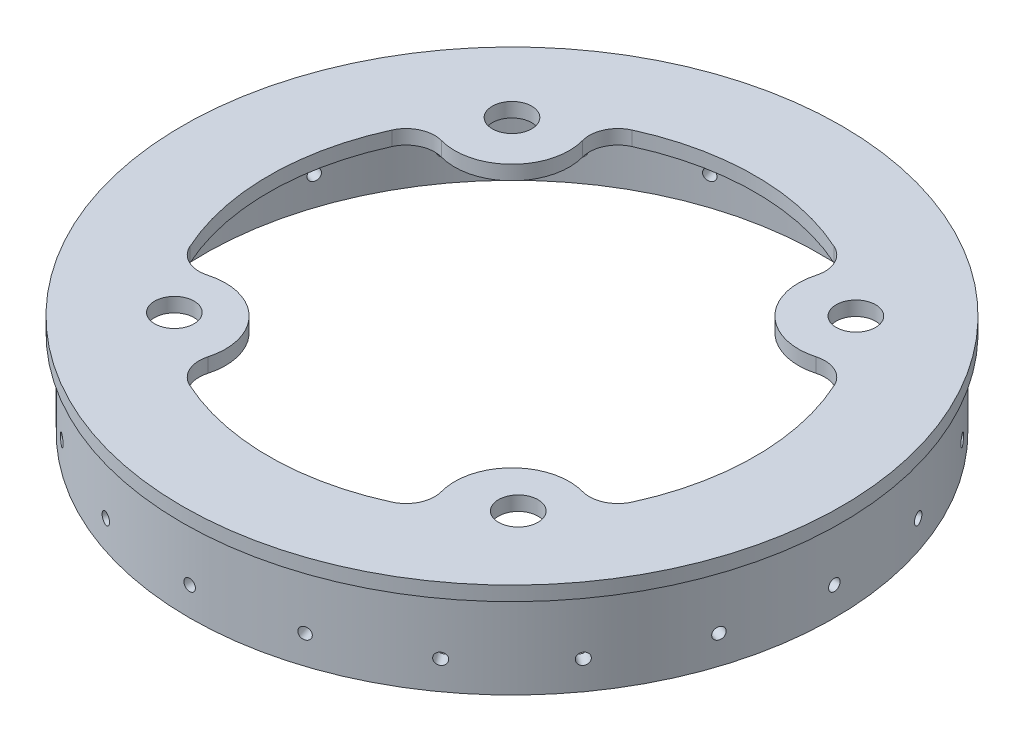
from build123d import *

# Parameters (mm, degrees)
F_1_4_20_TAPPED_HOLE1_REACH  = 327.294
F_1_4_20_TAPPED_HOLE1_BORE_R = 2.5527
CIRPATTERN2_COUNT            = 20
BOSS_EXTRUDE1_START          = -6.35
SKETCH6_R                    = 136.525
BOSS_EXTRUDE1_DEPTH          = 6.35
FILLET1_R                    = 12.7
CHAMFER1_SIZE                = 12.7
F_3_4_16_TAPPED_HOLE1_D      = 17.4625


with BuildPart() as part:
    # Sketch1 → Revolve1 (revolve)
    with BuildSketch(Plane.XY, mode=Mode.PRIVATE) as revolve1_sk:
        Polygon((136.525, 0), (142.875, 0), (142.875, 38.1), (146.05, 38.1), (146.05, 44.45), (136.525, 44.45), align=None)
    revolve(revolve1_sk.sketch.rotate(Axis((0, 75.595186151, 0), (0, -1, 0)), 90), axis=Axis((0, 75.595186151, 0), (0, -1, 0)))

    # 1/4-20 Tapped Hole1 bore (on position points) → 1/4-20 Tapped Hole1 (cut, up to next)
    with BuildSketch(Plane(origin=(-142.875, 12.7, 0), x_dir=(0, 0, -1), z_dir=(-1, 0, 0)), mode=Mode.PRIVATE) as f_1_4_20_tapped_hole1_sk1:
        Circle(F_1_4_20_TAPPED_HOLE1_BORE_R)
    f_1_4_20_tapped_hole1_tool1 = extrude(f_1_4_20_tapped_hole1_sk1.sketch, amount=-F_1_4_20_TAPPED_HOLE1_REACH, mode=Mode.PRIVATE) & part.part
    f_1_4_20_tapped_hole1 = f_1_4_20_tapped_hole1_tool1.solids().sort_by_distance((-142.875, 12.7, 0))[0]
    add(f_1_4_20_tapped_hole1, mode=Mode.SUBTRACT)

    # CirPattern2: 1/4-20 Tapped Hole1 ×20 about axis
    cirpattern2_axis = Axis((0, 75.595186151, 0), (0, 1, 0))
    for i in range(1, CIRPATTERN2_COUNT):
        add(f_1_4_20_tapped_hole1.rotate(cirpattern2_axis, i * 360 / CIRPATTERN2_COUNT), mode=Mode.SUBTRACT)

    # Sketch6 → Boss-Extrude1 (add)
    with BuildSketch(Plane(origin=(0, 44.45, 0), x_dir=(1, 0, 0), z_dir=(0, 1, 0)).offset(BOSS_EXTRUDE1_START)):
        with Locations(Location((0, 0, 0), (0, 0, 270))):
            Circle(SKETCH6_R)
        with BuildLine():
            ThreePointArc((-91.918683687, 56.24798298), (-58.239487758, 58.239487758), (-56.24798298, 91.918683687))
            ThreePointArc((-56.24798298, 91.918683687), (0, 107.763073453), (56.24798298, 91.918683687))
            ThreePointArc((56.24798298, 91.918683687), (58.239487758, 58.239487758), (91.918683687, 56.24798298))
            ThreePointArc((91.918683687, 56.24798298), (107.763073453, 0), (91.918683687, -56.24798298))
            ThreePointArc((91.918683687, -56.24798298), (58.239487758, -58.239487758), (56.24798298, -91.918683687))
            ThreePointArc((56.24798298, -91.918683687), (0, -107.763073453), (-56.24798298, -91.918683687))
            ThreePointArc((-56.24798298, -91.918683687), (-58.239487758, -58.239487758), (-91.918683687, -56.24798298))
            ThreePointArc((-91.918683687, -56.24798298), (-107.763073453, 0), (-91.918683687, 56.24798298))
        make_face(mode=Mode.SUBTRACT)
    extrude(amount=BOSS_EXTRUDE1_DEPTH)

    # Fillet1
    fillet1_edges = [part.edges().sort_by_distance(p)[0] for p in [
        (-56.24798298, 41.275, 91.918683687),
        (-91.918683687, 41.275, 56.24798298),
        (-91.918683687, 41.275, -56.24798298),
        (-56.24798298, 41.275, -91.918683687),
        (56.24798298, 41.275, -91.918683687),
        (91.918683687, 41.275, -56.24798298),
        (91.918683687, 41.275, 56.24798298),
        (56.24798298, 41.275, 91.918683687),
    ]]
    fillet(fillet1_edges, radius=FILLET1_R)

    # Chamfer1
    chamfer1_edges = [part.edges().sort_by_distance(p)[0] for p in [
        (0, 38.1, -136.525),
    ]]
    chamfer(chamfer1_edges, length=CHAMFER1_SIZE)

    # 3/4-16 Tapped Hole1 (through all)
    with Locations(Plane(origin=(-76.2, 44.45, -76.2), x_dir=(0, 0, 1), z_dir=(0, 1, 0))):
        with Locations((0, 0), (149.630484929, 0), (149.630484929, 152.4), (0, 152.4)):
            Hole(F_3_4_16_TAPPED_HOLE1_D / 2)


solid = part.part
